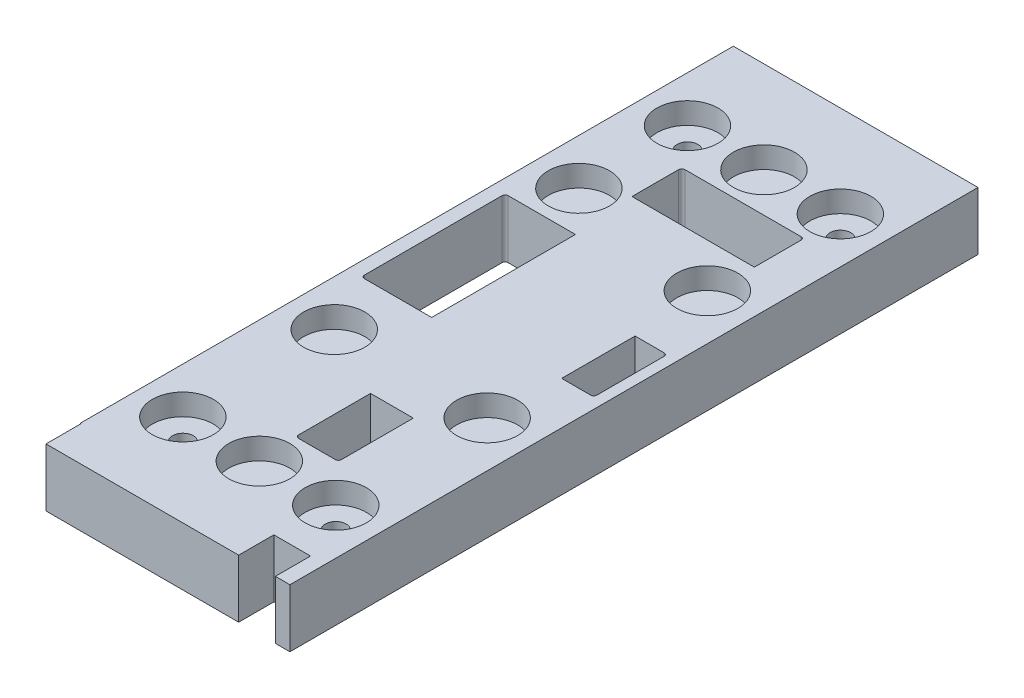
from build123d import *

# Parameters (mm, degrees)
SKETCH1_W           = 80
SKETCH1_H           = 225
BOSS_EXTRUDE1_DEPTH = 19
CUT_EXTRUDE1_REACH  = 122.902
SKETCH4_R           = 10
CUT_EXTRUDE2_DEPTH  = 7
SKETCH5_R           = 8.5
CUT_EXTRUDE3_DEPTH  = 5
CUT_EXTRUDE4_REACH  = 122.902
SKETCH7_W           = 12
SKETCH7_H           = 11.5
SKETCH7_W_2         = 1
M8_TAPPED_HOLE1_D   = 6.8


with BuildPart() as part:
    # Sketch1 → Boss-Extrude1 (new body)
    with BuildSketch(Plane(origin=(0, 0, 0), x_dir=(1, 0, 0), z_dir=(0, 1, 0))):
        Rectangle(SKETCH1_W, SKETCH1_H)
    extrude(amount=-BOSS_EXTRUDE1_DEPTH)

    # Sketch2 → Cut-Extrude1 (cut, up to next)
    with BuildSketch(Plane(origin=(0, 0, 0), x_dir=(1, 0, 0), z_dir=(0, 1, 0)), mode=Mode.PRIVATE) as cut_extrude1_sk1:
        with BuildLine():
            Line((-34.5, -13.64), (-12.5, -13.64))
            Line((-12.5, -13.64), (-12.5, 33.36))
            Line((-12.5, 33.36), (-34.5, 33.36))
            ThreePointArc((-34.5, 33.36), (-35.207106781, 33.067106781), (-35.5, 32.36))
            Line((-35.5, 32.36), (-35.5, -12.64))
            ThreePointArc((-35.5, -12.64), (-35.207106781, -13.347106781), (-34.5, -13.64))
        make_face()
    cut_extrude1_tool1 = extrude(cut_extrude1_sk1.sketch, amount=-CUT_EXTRUDE1_REACH, mode=Mode.PRIVATE) & part.part
    # Sketch2 → Cut-Extrude1 (cut, up to next)
    with BuildSketch(Plane(origin=(0, 0, 0), x_dir=(1, 0, 0), z_dir=(0, 1, 0)), mode=Mode.PRIVATE) as cut_extrude1_sk2:
        with BuildLine():
            Line((0, -69.64), (12, -69.64))
            ThreePointArc((12, -69.64), (12.707106781, -69.347106781), (13, -68.64))
            Line((13, -68.64), (13, -45.14))
            Line((13, -45.14), (-1, -45.14))
            Line((-1, -45.14), (-1, -68.64))
            ThreePointArc((-1, -68.64), (-0.707106781, -69.347106781), (0, -69.64))
        make_face()
    cut_extrude1_tool2 = extrude(cut_extrude1_sk2.sketch, amount=-CUT_EXTRUDE1_REACH, mode=Mode.PRIVATE) & part.part
    # Sketch2 → Cut-Extrude1 (cut, up to next)
    with BuildSketch(Plane(origin=(0, 0, 0), x_dir=(1, 0, 0), z_dir=(0, 1, 0)), mode=Mode.PRIVATE) as cut_extrude1_sk3:
        with BuildLine():
            Line((35.5, 14.36), (26, 14.36))
            Line((26, 14.36), (26, -9.64))
            Line((26, -9.64), (35.5, -9.64))
            ThreePointArc((35.5, -9.64), (36.207106781, -9.347106781), (36.5, -8.64))
            Line((36.5, -8.64), (36.5, 13.36))
            ThreePointArc((36.5, 13.36), (36.207106781, 14.067106781), (35.5, 14.36))
        make_face()
    cut_extrude1_tool3 = extrude(cut_extrude1_sk3.sketch, amount=-CUT_EXTRUDE1_REACH, mode=Mode.PRIVATE) & part.part
    # Sketch2 → Cut-Extrude1 (cut, up to next)
    with BuildSketch(Plane(origin=(0, 0, 0), x_dir=(1, 0, 0), z_dir=(0, 1, 0)), mode=Mode.PRIVATE) as cut_extrude1_sk4:
        with BuildLine():
            Line((26, 53.36), (26, 68.64))
            ThreePointArc((26, 68.64), (25.707106781, 69.347106781), (25, 69.64))
            Line((25, 69.64), (-13, 69.64))
            ThreePointArc((-13, 69.64), (-13.707106781, 69.347106781), (-14, 68.64))
            Line((-14, 68.64), (-14, 53.36))
            Line((-14, 53.36), (26, 53.36))
        make_face()
    cut_extrude1_tool4 = extrude(cut_extrude1_sk4.sketch, amount=-CUT_EXTRUDE1_REACH, mode=Mode.PRIVATE) & part.part
    add(cut_extrude1_tool1.solids().sort_by_distance((-23.995521, 0, -9.86))[0], mode=Mode.SUBTRACT)
    add(cut_extrude1_tool2.solids().sort_by_distance((6, 0, 57.374932))[0], mode=Mode.SUBTRACT)
    add(cut_extrude1_tool3.solids().sort_by_distance((31.241424, 0, -2.36))[0], mode=Mode.SUBTRACT)
    add(cut_extrude1_tool4.solids().sort_by_distance((6, 0, -61.494779))[0], mode=Mode.SUBTRACT)

    # Sketch4 → Cut-Extrude2 (cut)
    with BuildSketch(Plane(origin=(0, 0, 0), x_dir=(1, 0, 0), z_dir=(0, 1, 0))):
        with Locations(Location((25, -82.5, 0), (0, 0, 270))):
            Circle(SKETCH4_R)
        with Locations(Location((0, -82.5, 0), (0, 0, 270))):
            Circle(SKETCH4_R)
        with Locations(Location((-25, -82.5, 0), (0, 0, 270))):
            Circle(SKETCH4_R)
        with Locations(Location((-25, -33, 0), (0, 0, 270))):
            Circle(SKETCH4_R)
        with Locations(Location((25, -33, 0), (0, 0, 270))):
            Circle(SKETCH4_R)
        with Locations(Location((25, 39, 0), (0, 0, 270))):
            Circle(SKETCH4_R)
        with Locations(Location((-25, 47, 0), (0, 0, 270))):
            Circle(SKETCH4_R)
        with Locations(Location((-25, 82.5, 0), (0, 0, 270))):
            Circle(SKETCH4_R)
        with Locations(Location((0, 82.5, 0), (0, 0, 270))):
            Circle(SKETCH4_R)
        with Locations(Location((25, 82.5, 0), (0, 0, 270))):
            Circle(SKETCH4_R)
    extrude(amount=-CUT_EXTRUDE2_DEPTH, mode=Mode.SUBTRACT)

    # Sketch5 → Cut-Extrude3 (cut)
    with BuildSketch(Plane.XZ.offset(19)):
        with Locations(Location((6, 100, 0), (0, 0, 270))):
            Circle(SKETCH5_R)
        with Locations(Location((6, -100, 0), (0, 0, 270))):
            Circle(SKETCH5_R)
    extrude(amount=-CUT_EXTRUDE3_DEPTH, mode=Mode.SUBTRACT)

    # Sketch7 → Cut-Extrude4 (cut, up to next)
    with BuildSketch(Plane(origin=(0, 0, 0), x_dir=(1, 0, 0), z_dir=(0, 1, 0)), mode=Mode.PRIVATE) as cut_extrude4_sk1:
        with Locations((29.25, -106.75)):
            Rectangle(SKETCH7_W, SKETCH7_H)
    cut_extrude4_tool1 = extrude(cut_extrude4_sk1.sketch, amount=-CUT_EXTRUDE4_REACH, mode=Mode.PRIVATE) & part.part
    # Sketch7 → Cut-Extrude4 (cut, up to next)
    with BuildSketch(Plane(origin=(0, 0, 0), x_dir=(1, 0, 0), z_dir=(0, 1, 0)), mode=Mode.PRIVATE) as cut_extrude4_sk2:
        with Locations((-40.25, -106.75)):
            Rectangle(SKETCH7_W_2, SKETCH7_H)
    cut_extrude4_tool2 = extrude(cut_extrude4_sk2.sketch, amount=-CUT_EXTRUDE4_REACH, mode=Mode.PRIVATE) & part.part
    add(cut_extrude4_tool1.solids().sort_by_distance((29.25, 0, 106.75))[0], mode=Mode.SUBTRACT)
    add(cut_extrude4_tool2.solids().sort_by_distance((-40.25, 0, 106.75))[0], mode=Mode.SUBTRACT)

    # M8 Tapped Hole1 (through all)
    with Locations(Plane(origin=(0, 0, 0), x_dir=(1, 0, 0), z_dir=(0, 1, 0))):
        with Locations((-25, 82.5), (25, 82.5), (25, -82.5), (-25, -82.5)):
            Hole(M8_TAPPED_HOLE1_D / 2)


solid = part.part
